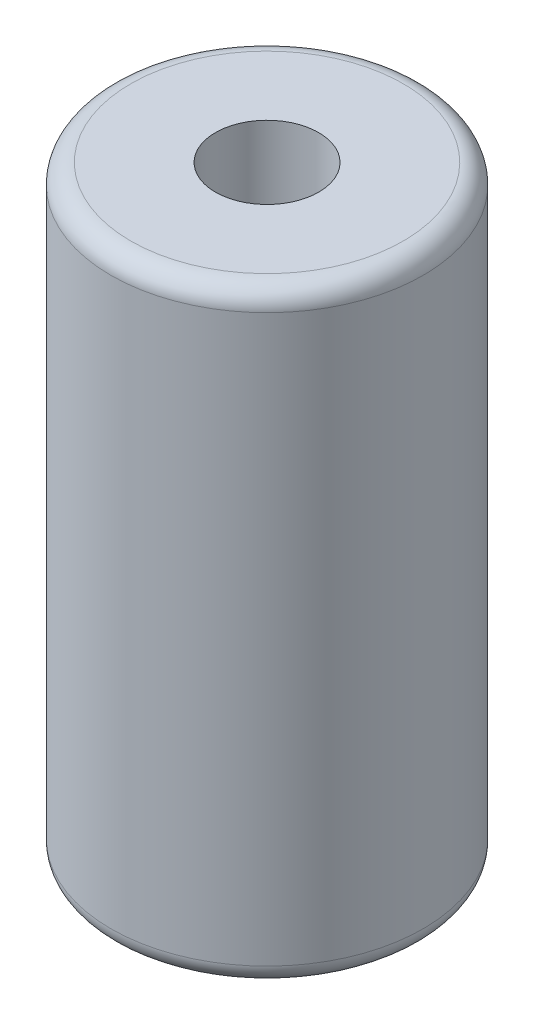
from build123d import *

# Parameters (mm, degrees)
SKETCH1_R           = 3.175
SKETCH1_R_2         = 1.05
BOSS_EXTRUDE1_DEPTH = 12.317
FILLET1_R           = 0.403174603


with BuildPart() as part:
    # Sketch1 → Boss-Extrude1 (new body)
    with BuildSketch(Plane(origin=(0, 0, 0), x_dir=(1, 0, 0), z_dir=(0, 1, 0))):
        with Locations(Location((0, 0, 0), (0, 0, 270))):
            Circle(SKETCH1_R)
        with Locations(Location((0, 0, 0), (0, 0, 270))):
            Circle(SKETCH1_R_2, mode=Mode.SUBTRACT)
    extrude(amount=BOSS_EXTRUDE1_DEPTH)

    # Fillet1
    fillet1_edges = [part.edges().sort_by_distance(p)[0] for p in [
        (0, 0, -3.175),
        (0, 12.317, -3.175),
    ]]
    fillet(fillet1_edges, radius=FILLET1_R)


solid = part.part
